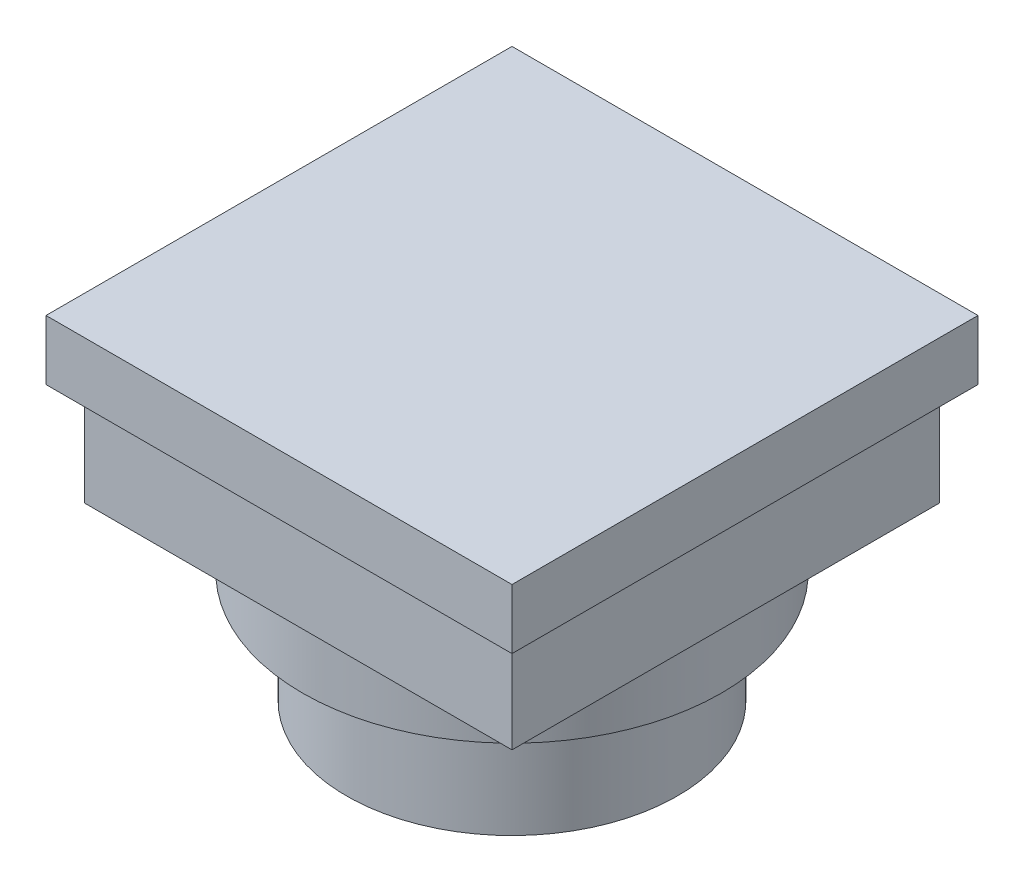
from build123d import *

# Parameters (mm, degrees)
SKETCH1_W           = 5.45
SKETCH1_H           = 5.45
BOSS_EXTRUDE1_DEPTH = 0.7
SKETCH2_W           = 5
SKETCH2_H           = 5
BOSS_EXTRUDE2_DEPTH = 1.2
SKETCH4_R           = 2.45
BOSS_EXTRUDE3_DEPTH = 0.7
SKETCH5_R           = 1.935
SKETCH5_R_2         = 0.35
BOSS_EXTRUDE4_DEPTH = 1.3


with BuildPart() as part:
    # Sketch1 → Boss-Extrude1 (new body)
    with BuildSketch(Plane(origin=(0, 0, 0), x_dir=(1, 0, 0), z_dir=(0, 1, 0))):
        Rectangle(SKETCH1_W, SKETCH1_H)
    extrude(amount=BOSS_EXTRUDE1_DEPTH)

    # Sketch2 → Boss-Extrude2 (add)
    with BuildSketch(Plane.XZ):
        Rectangle(SKETCH2_W, SKETCH2_H)
    extrude(amount=BOSS_EXTRUDE2_DEPTH)

    # Sketch4 → Boss-Extrude3 (add)
    with BuildSketch(Plane.XZ.offset(1.2)):
        with Locations(Location((0, 0, 0), (0, 0, 270))):
            Circle(SKETCH4_R)
    extrude(amount=BOSS_EXTRUDE3_DEPTH)

    # Sketch5 → Boss-Extrude4 (add)
    with BuildSketch(Plane.XZ.offset(1.9)):
        with Locations(Location((0, 0, 0), (0, 0, 270))):
            Circle(SKETCH5_R)
        with Locations(Location((0, 0, 0), (0, 0, 270))):
            Circle(SKETCH5_R_2, mode=Mode.SUBTRACT)
    extrude(amount=BOSS_EXTRUDE4_DEPTH)


solid = part.part
